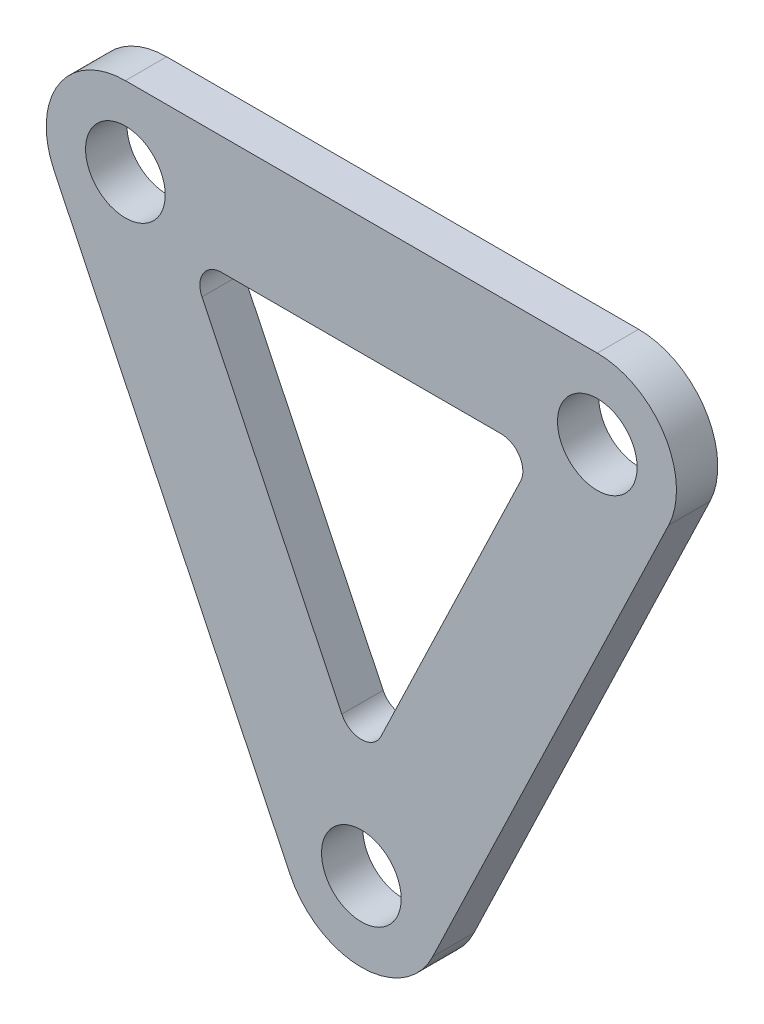
from build123d import *

# Parameters (mm, degrees)
SKETCH_1_R          = 2.025
EXTRUDE_1_DEPTH     = 2.1
CUT_EXTRUDE_1_DEPTH = 21.1
FILLET_1_R          = 1.1


with BuildPart() as part:
    # 草图1 → 凸台-拉伸1 (new body)
    with BuildSketch(Plane.XY):
        with BuildLine():
            Line((-12, 16.525), (12, 16.525))
            ThreePointArc((12, 16.525), (15.406694788, 14.643608085), (15.628630306, 10.758257453))
            Line((15.628630306, 10.758257453), (3.628630306, -14.241742547))
            ThreePointArc((3.628630306, -14.241742547), (0, -16.525), (-3.628630306, -14.241742547))
            Line((-3.628630306, -14.241742547), (-15.628630306, 10.758257453))
            ThreePointArc((-15.628630306, 10.758257453), (-15.406694788, 14.643608085), (-12, 16.525))
        make_face()
        with Locations((-12, 12.5)):
            Circle(SKETCH_1_R, mode=Mode.SUBTRACT)
        with Locations((12, 12.5)):
            Circle(SKETCH_1_R, mode=Mode.SUBTRACT)
        with Locations((0, -12.5)):
            Circle(SKETCH_1_R, mode=Mode.SUBTRACT)
    extrude(amount=EXTRUDE_1_DEPTH)

    # 草图2 → 切除-拉伸1 (cut)
    with BuildSketch(Plane.XY.offset(2.1)):
        Polygon((-8.861262909, 10.525), (0, -7.935964395), (8.861262909, 10.525), align=None)
    extrude(amount=-CUT_EXTRUDE_1_DEPTH, mode=Mode.SUBTRACT)

    # 圆角1
    fillet_1_edges = [part.edges().sort_by_distance(p)[0] for p in [
        (-8.861262909, 10.525, 1.05),
        (8.861262909, 10.525, 1.05),
        (0, -7.935964395, 1.05),
    ]]
    fillet(fillet_1_edges, radius=FILLET_1_R)


solid = part.part
